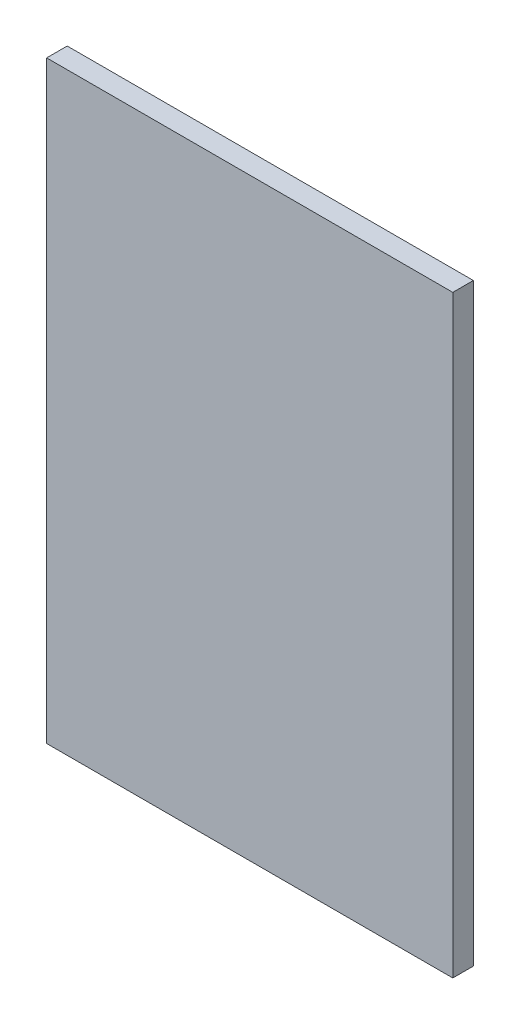
from build123d import *

# Parameters (mm, degrees)
SKETCH1_W           = 250.825
SKETCH1_H           = 366.7252
BOSS_EXTRUDE1_DEPTH = 6.35


with BuildPart() as part:
    # Sketch1 → Boss-Extrude1 (new, symmetric)
    with BuildSketch(Plane.XY):
        Rectangle(SKETCH1_W, SKETCH1_H)
    extrude(amount=BOSS_EXTRUDE1_DEPTH, both=True)


solid = part.part
